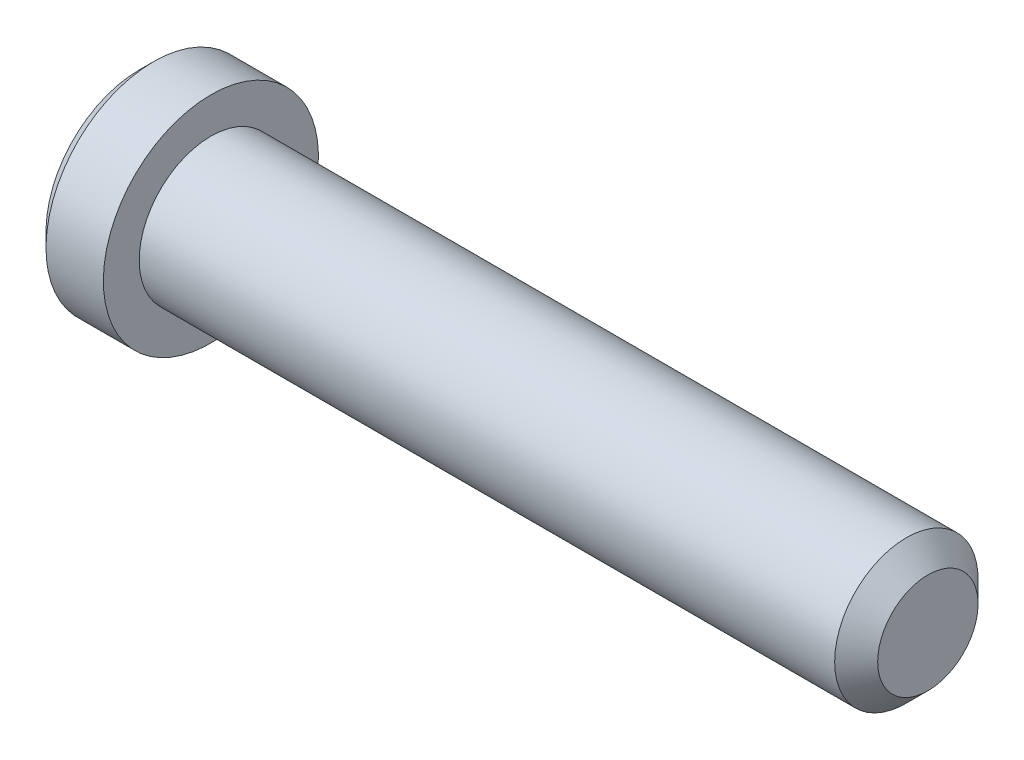
from build123d import *

# Parameters (mm, degrees)
SKETCH2_R           = 3.175
BOSS_EXTRUDE1_DEPTH = 31.75
CHAMFER1_SIZE       = 0.9525
CUT_EXTRUDE1_DEPTH  = 2.3876


with BuildPart() as part:
    # Sketch2 → Boss-Extrude1 (new body)
    with BuildSketch(Plane(origin=(15.875, 0, 0), x_dir=(0, 0, -1), z_dir=(1, 0, 0))):
        Circle(SKETCH2_R)
    extrude(amount=-BOSS_EXTRUDE1_DEPTH)

    # Chamfer1
    chamfer1_edges = [part.edges().sort_by_distance(p)[0] for p in [
        (15.875, 0, 3.175),
    ]]
    chamfer(chamfer1_edges, length=CHAMFER1_SIZE)

    # Sketch6 → Revolve1 (revolve)
    with BuildSketch(Plane.XY):
        Polygon((-18.415, 4.7625), (-19.05, 4.1275), (-19.05, 0), (-15.875, 0), (-15.875, 4.7625), align=None)
    revolve(axis=Axis((-15.875, 0, 0), (-1, 0, 0)))

    # Sketch4 → Cut-Extrude1 (cut)
    with BuildSketch(Plane(origin=(-19.05, 0, 0), x_dir=(0, 0, -1), z_dir=(1, 0, 0))):
        Polygon((0, 1.833087105), (-1.5875, 0.916543552), (-1.5875, -0.916543552), (0, -1.833087105), (1.5875, -0.916543552), (1.5875, 0.916543552), align=None)
    extrude(amount=CUT_EXTRUDE1_DEPTH, mode=Mode.SUBTRACT)

    # Cut-Extrude2 cone 1 section (through the dimple's axis) → Cut-Extrude2 (revolve, cut)
    with BuildSketch(Plane(origin=(-19.05, 0, 0), x_dir=(0, 0, 1), z_dir=(0, 1, 0))):
        Polygon((0, 0), (1.833087105, 0), (0, 1.833087105), align=None)
    revolve(axis=Axis((-19.05, 0, 0), (1, 0, 0)), mode=Mode.SUBTRACT)


solid = part.part
